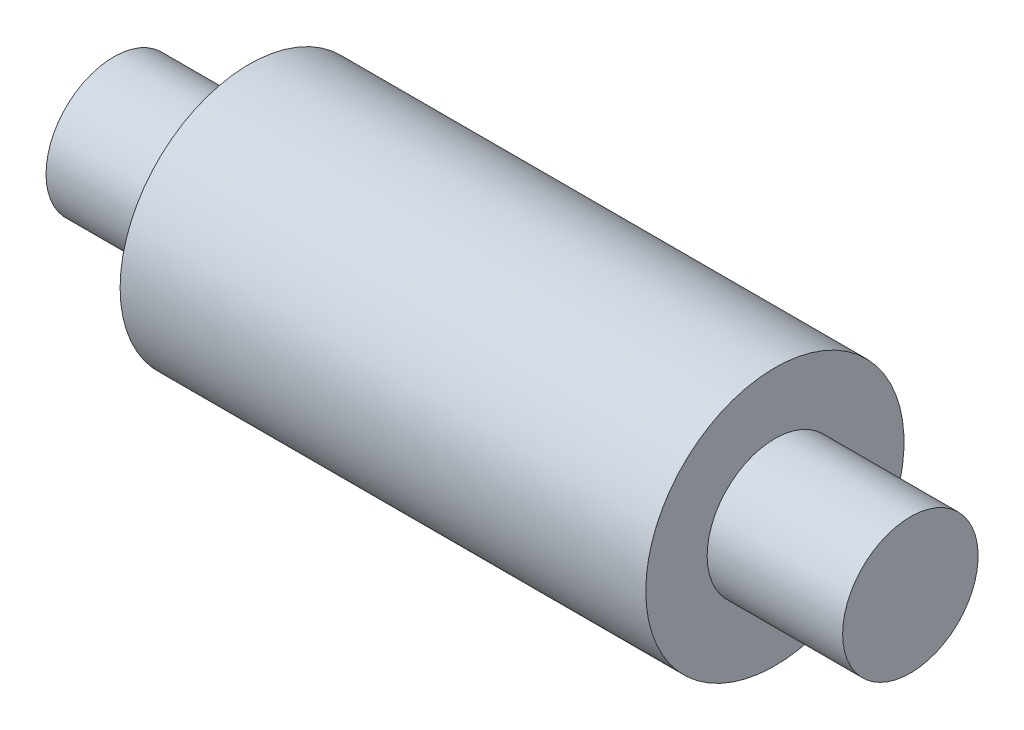
from build123d import *


with BuildPart() as part:
    # Sketch1 → Revolve1 (revolve)
    with BuildSketch(Plane.XY):
        Polygon((-37.338, 0), (37.338, 0), (37.338, 6.35), (24.638, 6.35), (24.638, 12.1031), (-24.638, 12.1031), (-24.638, 6.35), (-37.338, 6.35), align=None)
    revolve(axis=Axis((-37.338, 0, 0), (1, 0, 0)))


solid = part.part
